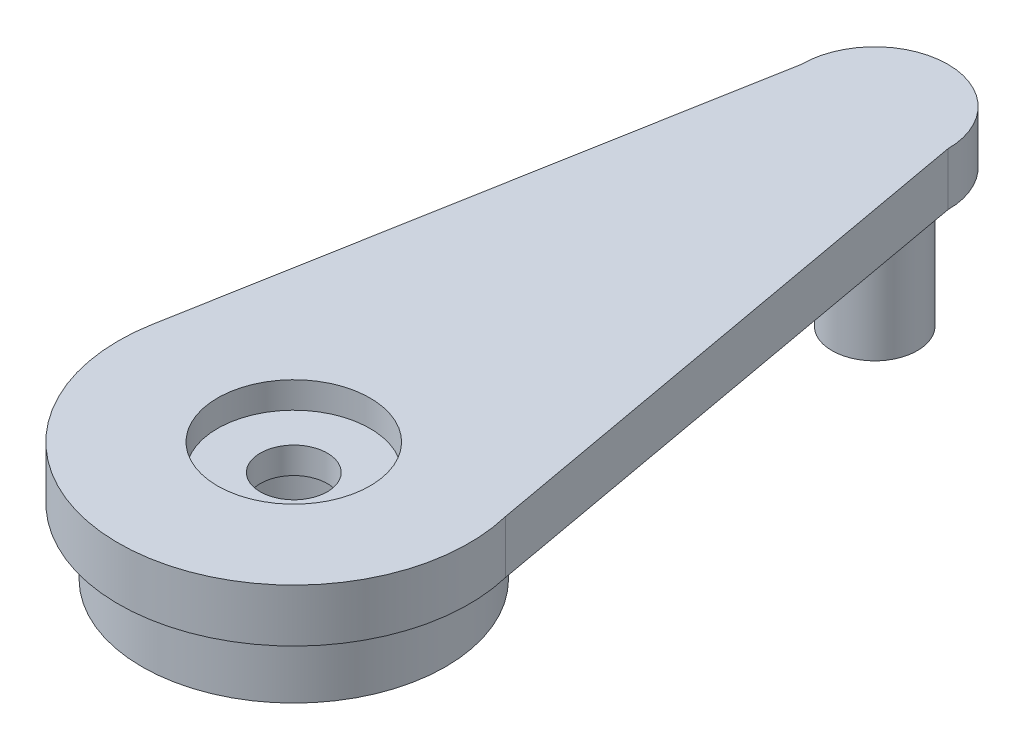
from build123d import *

# Parameters (mm, degrees)
SKETCH1_R           = 2.887093213
BOSS_EXTRUDE1_DEPTH = 2
SKETCH1_4_R         = 2.887093213
SKETCH1_4_R_2       = 1.270321014
BOSS_EXTRUDE2_DEPTH = 1
SKETCH1_6_R         = 1.616772199
BOSS_EXTRUDE5_DEPTH = 5.2
SKETCH3_R           = 5.75
SKETCH3_R_2         = 2.5
BOSS_EXTRUDE6_DEPTH = 2.5


with BuildPart() as part:
    # Sketch1 → Boss-Extrude1 (new body)
    with BuildSketch(Plane(origin=(0, 0, 0), x_dir=(1, 0, 0), z_dir=(0, 1, 0))):
        with BuildLine():
            Line((48.924361083, -34.984798737), (45.240075768, -14.546907598))
            ThreePointArc((45.240075768, -14.546907598), (42.468466284, -11.775298114), (39.6968568, -14.546907598))
            Line((39.6968568, -14.546907598), (35.935854194, -35.366456871))
            ThreePointArc((35.935854194, -35.366456871), (42.66543851, -43.184357012), (48.924361083, -34.984798737))
        make_face()
        with Locations((42.470401728, -36.546907513)):
            Circle(SKETCH1_R, mode=Mode.SUBTRACT)
    extrude(amount=BOSS_EXTRUDE1_DEPTH)

    # Sketch1<4> → Boss-Extrude2 (add)
    with BuildSketch(Plane(origin=(0, 0, 0), x_dir=(1, 0, 0), z_dir=(0, 1, 0))):
        with Locations((42.470401728, -36.546907513)):
            Circle(SKETCH1_4_R)
        with Locations((42.470401728, -36.546907513)):
            Circle(SKETCH1_4_R_2, mode=Mode.SUBTRACT)
    extrude(amount=BOSS_EXTRUDE2_DEPTH)

    # Sketch1<6> → Boss-Extrude5 (add)
    with BuildSketch(Plane(origin=(0, 0, 0), x_dir=(1, 0, 0), z_dir=(0, 1, 0))):
        with Locations((42.468466284, -14.546907598)):
            Circle(SKETCH1_6_R)
    extrude(amount=-BOSS_EXTRUDE5_DEPTH)

    # Sketch3 → Boss-Extrude6 (add)
    with BuildSketch(Plane.XZ):
        with Locations((42.470401728, 36.546907513)):
            Circle(SKETCH3_R)
        with Locations((42.470401728, 36.546907513)):
            Circle(SKETCH3_R_2, mode=Mode.SUBTRACT)
    extrude(amount=BOSS_EXTRUDE6_DEPTH)


solid = part.part
